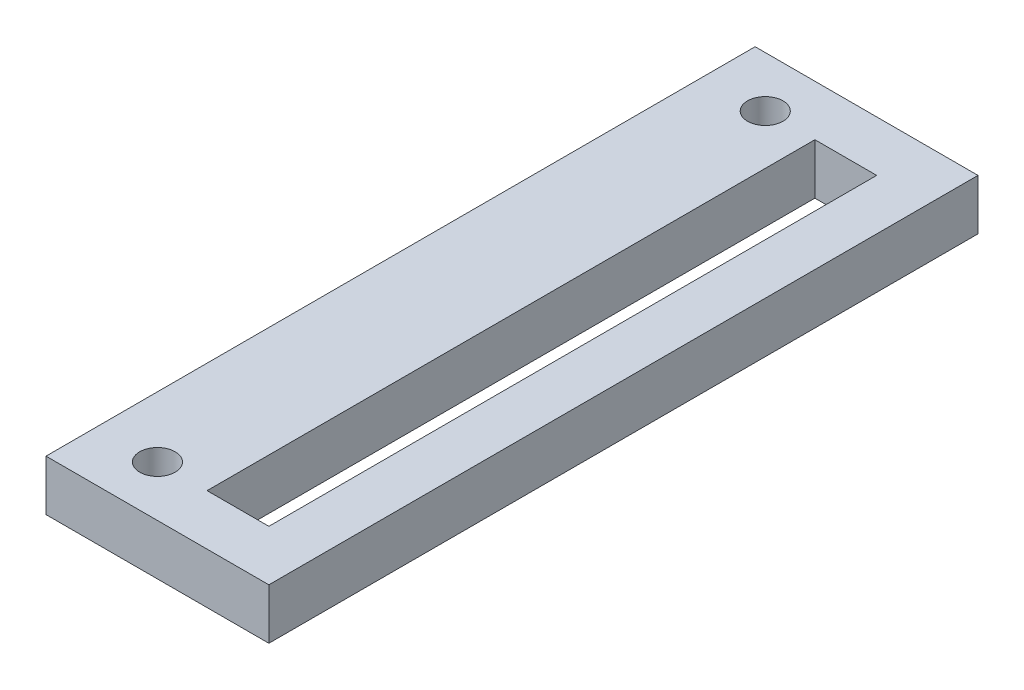
from build123d import *

# Parameters (mm, degrees)
SKETCH1_W           = 22
SKETCH1_H           = 70
SKETCH1_R           = 1.75
SKETCH1_W_2         = 6.1
SKETCH1_H_2         = 60
BOSS_EXTRUDE1_DEPTH = 5


with BuildPart() as part:
    # Sketch1 → Boss-Extrude1 (new body)
    with BuildSketch(Plane(origin=(0, 0, 0), x_dir=(1, 0, 0), z_dir=(0, 1, 0))):
        with Locations((11, 35)):
            Rectangle(SKETCH1_W, SKETCH1_H)
        with Locations(Location((6, 65, 0), (0, 0, 270))):
            Circle(SKETCH1_R, mode=Mode.SUBTRACT)
        with Locations(Location((6, 5, 0), (0, 0, 90))):
            Circle(SKETCH1_R, mode=Mode.SUBTRACT)
        with Locations((13.95, 35)):
            Rectangle(SKETCH1_W_2, SKETCH1_H_2, mode=Mode.SUBTRACT)
    extrude(amount=BOSS_EXTRUDE1_DEPTH)


solid = part.part
